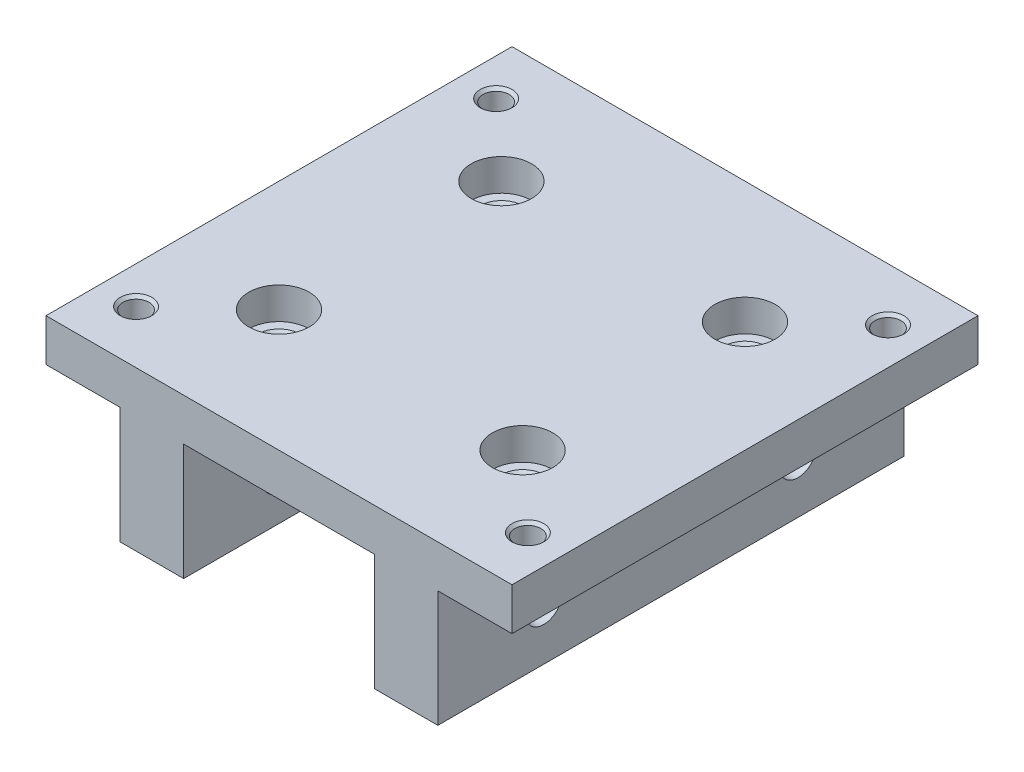
from build123d import *
from build123d.topology import SkipClean

# Parameters (mm, degrees)
BOSS_EXTRUDE1_DEPTH = 44
SKETCH8_R           = 1.75
CUT_EXTRUDE1_DEPTH  = 7
SKETCH9_R           = 1.75
CUT_EXTRUDE2_DEPTH  = 7
CUT_EXTRUDE3_START  = 7
SKETCH10_R          = 1.75
CUT_EXTRUDE3_DEPTH  = 7
CUT_EXTRUDE4_START  = 7
SKETCH11_R          = 1.75
CUT_EXTRUDE4_DEPTH  = 7


with BuildPart() as part:
    # Sketch1 → Boss-Extrude1 (new body)
    with BuildSketch(Plane.XY):
        Polygon((-22, 15), (-22, 11), (-15, 11), (-15, 0), (-9, 0), (-9, 11), (9, 11), (9, 0), (15, 0), (15, 11), (22, 11), (22, 15), align=None)
    extrude(amount=BOSS_EXTRUDE1_DEPTH)

    # Sketch2 → Cut-Revolve1 (revolve, cut)
    with BuildSketch(Plane.XY.offset(5), mode=Mode.PRIVATE) as cut_revolve1_sk:
        Polygon((18.5, 15), (20, 15), (19.7295, 14.7295), (19.7295, 11.2705), (20, 11), (18.5, 11), align=None)
    revolve(cut_revolve1_sk.sketch.rotate(Axis((18.5, 11, 5), (0, 1, 0)), 270), axis=Axis((18.5, 11, 5), (0, 1, 0)), mode=Mode.SUBTRACT)

    # Sketch3 → Cut-Revolve2 (revolve, cut)
    with BuildSketch(Plane.XY.offset(39), mode=Mode.PRIVATE) as cut_revolve2_sk:
        Polygon((18.5, 15), (20, 15), (19.7295, 14.7295), (19.7295, 11.2705), (20, 11), (18.5, 11), align=None)
    revolve(cut_revolve2_sk.sketch.rotate(Axis((18.5, 11, 39), (0, 1, 0)), 270), axis=Axis((18.5, 11, 39), (0, 1, 0)), mode=Mode.SUBTRACT)

    # Sketch4 → Revolve1 (revolve)
    with SkipClean():  # the faces are left unmerged after this step: merging them gives an invalid solid
        with BuildSketch(Plane.XY.offset(10)):
            with BuildLine():
                Line((-10.07, 1.95), (-10.07, 8.05))
                ThreePointArc((-10.07, 8.05), (-7.02, 5), (-10.07, 1.95))
            make_face()
        revolve(axis=Axis((-10.07, -50, 10), (0, 1, 0)))

    # Sketch5 → Revolve2 (revolve)
    with SkipClean():  # the faces are left unmerged after this step: merging them gives an invalid solid
        with BuildSketch(Plane.XY.offset(34)):
            with BuildLine():
                Line((-10.07, 1.95), (-10.07, 8.05))
                ThreePointArc((-10.07, 8.05), (-7.02, 5), (-10.07, 1.95))
            make_face()
        revolve(axis=Axis((-10.07, -50, 34), (0, 1, 0)))

    # Sketch6 → Revolve3 (revolve)
    with SkipClean():  # the faces are left unmerged after this step: merging them gives an invalid solid
        with BuildSketch(Plane.XY.offset(34)):
            with BuildLine():
                Line((10.07, 8.05), (10.07, 1.95))
                ThreePointArc((10.07, 1.95), (7.02, 5), (10.07, 8.05))
            make_face()
        revolve(axis=Axis((10.07, 50, 34), (0, -1, 0)))

    # Sketch7 → Revolve4 (revolve)
    with SkipClean():  # the faces are left unmerged after this step: merging them gives an invalid solid
        with BuildSketch(Plane.XY.offset(10)):
            with BuildLine():
                Line((10.07, 8.05), (10.07, 1.95))
                ThreePointArc((10.07, 1.95), (7.02, 5), (10.07, 8.05))
            make_face()
        revolve(axis=Axis((10.07, 50, 10), (0, -1, 0)))

    # Sketch8 → Cut-Extrude1 (cut)
    with SkipClean():  # the faces are left unmerged after this step: merging them gives an invalid solid
        with BuildSketch(Plane(origin=(20.5, 0, 0), x_dir=(0, 0, -1), z_dir=(1, 0, 0))):
            with Locations((-10, 5)):
                Circle(SKETCH8_R)
        extrude(amount=-CUT_EXTRUDE1_DEPTH, mode=Mode.SUBTRACT)

    # Sketch9 → Cut-Extrude2 (cut)
    with SkipClean():  # the faces are left unmerged after this step: merging them gives an invalid solid
        with BuildSketch(Plane(origin=(20.5, 0, 0), x_dir=(0, 0, -1), z_dir=(1, 0, 0))):
            with Locations((-34, 5)):
                Circle(SKETCH9_R)
        extrude(amount=-CUT_EXTRUDE2_DEPTH, mode=Mode.SUBTRACT)

    # Sketch10 → Cut-Extrude3 (cut)
    with SkipClean():  # the faces are left unmerged after this step: merging them gives an invalid solid
        with BuildSketch(Plane(origin=(-20.5, 0, 0), x_dir=(0, 0, -1), z_dir=(1, 0, 0)).offset(CUT_EXTRUDE3_START)):
            with Locations((-10, 5)):
                Circle(SKETCH10_R)
        extrude(amount=-CUT_EXTRUDE3_DEPTH, mode=Mode.SUBTRACT)

    # Sketch11 → Cut-Extrude4 (cut)
    with SkipClean():  # the faces are left unmerged after this step: merging them gives an invalid solid
        with BuildSketch(Plane(origin=(-20.5, 0, 0), x_dir=(0, 0, -1), z_dir=(1, 0, 0)).offset(CUT_EXTRUDE4_START)):
            with Locations((-34, 5)):
                Circle(SKETCH11_R)
        extrude(amount=-CUT_EXTRUDE4_DEPTH, mode=Mode.SUBTRACT)

    # Sketch12 → Cut-Revolve3 (revolve, cut)
    with SkipClean():  # the faces are left unmerged after this step: merging them gives an invalid solid
        with BuildSketch(Plane.XY.offset(5), mode=Mode.PRIVATE) as cut_revolve3_sk:
            Polygon((-18.5, 15), (-17, 15), (-17.2705, 14.7295), (-17.2705, 11.2705), (-17, 11), (-18.5, 11), align=None)
        revolve(cut_revolve3_sk.sketch.rotate(Axis((-18.5, 11, 5), (0, 1, 0)), 270), axis=Axis((-18.5, 11, 5), (0, 1, 0)), mode=Mode.SUBTRACT)

    # Sketch13 → Cut-Revolve4 (revolve, cut)
    with SkipClean():  # the faces are left unmerged after this step: merging them gives an invalid solid
        with BuildSketch(Plane.XY.offset(39), mode=Mode.PRIVATE) as cut_revolve4_sk:
            Polygon((-18.5, 15), (-17, 15), (-17.2705, 14.7295), (-17.2705, 11.2705), (-17, 11), (-18.5, 11), align=None)
        revolve(cut_revolve4_sk.sketch.rotate(Axis((-18.5, 11, 39), (0, 1, 0)), 270), axis=Axis((-18.5, 11, 39), (0, 1, 0)), mode=Mode.SUBTRACT)

    # Sketch14 → Cut-Revolve5 (revolve, cut)
    with SkipClean():  # the faces are left unmerged after this step: merging them gives an invalid solid
        with BuildSketch(Plane(origin=(11.5, 0, 0), x_dir=(0, 0, -1), z_dir=(1, 0, 0)), mode=Mode.PRIVATE) as cut_revolve5_sk:
            Polygon((-11.5, 3.864115214), (-13.121, 4.8), (-13.121, 11.621), (-13.5, 12), (-14.35, 12), (-14.35, 15), (-11.5, 15), align=None)
        revolve(cut_revolve5_sk.sketch.rotate(Axis((11.5, 15, 11.5), (0, -1, 0)), 180), axis=Axis((11.5, 15, 11.5), (0, -1, 0)), mode=Mode.SUBTRACT)

    # Sketch15 → Cut-Revolve6 (revolve, cut)
    with SkipClean():  # the faces are left unmerged after this step: merging them gives an invalid solid
        with BuildSketch(Plane(origin=(11.5, 0, 0), x_dir=(0, 0, -1), z_dir=(1, 0, 0)), mode=Mode.PRIVATE) as cut_revolve6_sk:
            Polygon((-32.5, 15), (-29.65, 15), (-29.65, 12), (-30.5, 12), (-30.879, 11.621), (-30.879, 4.8), (-32.5, 3.864115214), align=None)
        revolve(cut_revolve6_sk.sketch.rotate(Axis((11.5, 3.864115214, 32.5), (0, 1, 0)), 180), axis=Axis((11.5, 3.864115214, 32.5), (0, 1, 0)), mode=Mode.SUBTRACT)

    # Sketch16 → Cut-Revolve7 (revolve, cut)
    with SkipClean():  # the faces are left unmerged after this step: merging them gives an invalid solid
        with BuildSketch(Plane(origin=(-11.5, 0, 0), x_dir=(0, 0, -1), z_dir=(1, 0, 0)), mode=Mode.PRIVATE) as cut_revolve7_sk:
            Polygon((-11.5, 3.864115214), (-13.121, 4.8), (-13.121, 11.621), (-13.5, 12), (-14.35, 12), (-14.35, 15), (-11.5, 15), align=None)
        revolve(cut_revolve7_sk.sketch.rotate(Axis((-11.5, 15, 11.5), (0, -1, 0)), 180), axis=Axis((-11.5, 15, 11.5), (0, -1, 0)), mode=Mode.SUBTRACT)

    # Sketch17 → Cut-Revolve8 (revolve, cut)
    with SkipClean():  # the faces are left unmerged after this step: merging them gives an invalid solid
        with BuildSketch(Plane(origin=(-11.5, 0, 0), x_dir=(0, 0, -1), z_dir=(1, 0, 0)), mode=Mode.PRIVATE) as cut_revolve8_sk:
            Polygon((-32.5, 15), (-29.65, 15), (-29.65, 12), (-30.5, 12), (-30.879, 11.621), (-30.879, 4.8), (-32.5, 3.864115214), align=None)
        revolve(cut_revolve8_sk.sketch.rotate(Axis((-11.5, 3.864115214, 32.5), (0, 1, 0)), 180), axis=Axis((-11.5, 3.864115214, 32.5), (0, 1, 0)), mode=Mode.SUBTRACT)


solid = part.part
